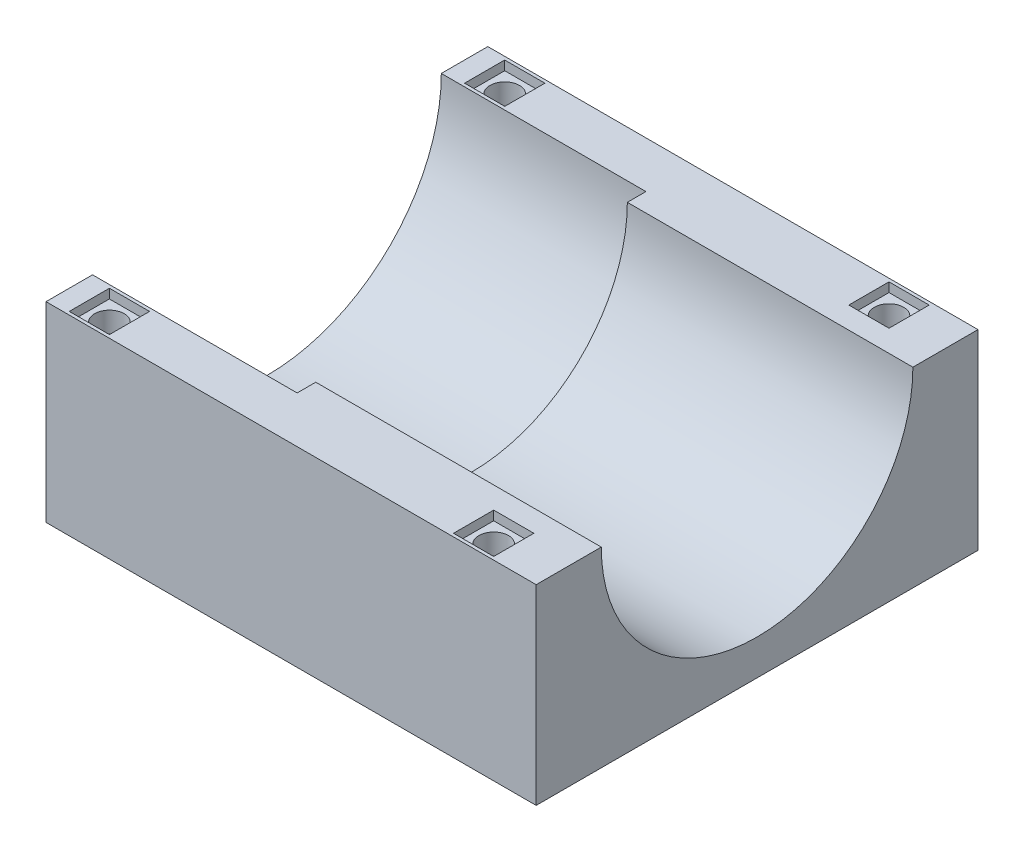
from build123d import *

# Parameters (mm, degrees)
SALIENTE_EXTRUIR1_DEPTH = 22
SALIENTE_EXTRUIR2_DEPTH = 30.7
CORTAR_EXTRUIR2_REACH   = 63.351
CROQUIS4_R              = 1.585
CROQUIS5_W              = 4.32
CROQUIS5_H              = 4.315133256
CROQUIS5_H_2            = 4.32
CORTAR_EXTRUIR3_DEPTH   = 1
CROQUIS6_W              = 4.32
CROQUIS6_H              = 4.32
CORTAR_EXTRUIR4_DEPTH   = 1


with BuildPart() as part:
    # Croquis1 → Saliente-Extruir1 (new body)
    with BuildSketch(Plane(origin=(0, 0, 0), x_dir=(0, 0, -1), z_dir=(1, 0, 0))):
        with BuildLine():
            Line((-23.75, 0), (-18.75, 0))
            ThreePointArc((-18.75, 0), (0, -18.75), (18.75, 0))
            Line((18.75, 0), (23.75, 0))
            Line((23.75, 0), (23.75, -20.555666233))
            Line((23.75, -20.555666233), (-23.75, -20.555666233))
            Line((-23.75, -20.555666233), (-23.75, 0))
        make_face()
    extrude(amount=SALIENTE_EXTRUIR1_DEPTH)

    # Croquis2 → Saliente-Extruir2 (add)
    with BuildSketch(Plane(origin=(22, 0, 0), x_dir=(0, 0, -1), z_dir=(1, 0, 0))):
        with BuildLine():
            Line((16.75, 0), (23.75, 0))
            Line((23.75, 0), (23.75, -20.555666233))
            Line((23.75, -20.555666233), (-23.75, -20.555666233))
            Line((-23.75, -20.555666233), (-23.75, 0))
            Line((-23.75, 0), (-16.75, 0))
            ThreePointArc((-16.75, 0), (0, -16.75), (16.75, 0))
        make_face()
    extrude(amount=SALIENTE_EXTRUIR2_DEPTH)

    # Croquis4 → Cortar-Extruir2 (cut, up to next)
    with BuildSketch(Plane(origin=(0, 0, 0), x_dir=(1, 0, 0), z_dir=(0, 1, 0)), mode=Mode.PRIVATE) as cortar_extruir2_sk1:
        with Locations(Location((4.31807399, 21.25, 0), (0, 0, 270))):
            Circle(CROQUIS4_R)
    cortar_extruir2_tool1 = extrude(cortar_extruir2_sk1.sketch, amount=-CORTAR_EXTRUIR2_REACH, mode=Mode.PRIVATE) & part.part
    # Croquis4 → Cortar-Extruir2 (cut, up to next)
    with BuildSketch(Plane(origin=(0, 0, 0), x_dir=(1, 0, 0), z_dir=(0, 1, 0)), mode=Mode.PRIVATE) as cortar_extruir2_sk2:
        with Locations(Location((45.631200307, 21.25, 0), (0, 0, 270))):
            Circle(CROQUIS4_R)
    cortar_extruir2_tool2 = extrude(cortar_extruir2_sk2.sketch, amount=-CORTAR_EXTRUIR2_REACH, mode=Mode.PRIVATE) & part.part
    cortar_extruir2_1 = cortar_extruir2_tool1.solids().sort_by_distance((4.318074, 0, -21.25))[0]
    add(cortar_extruir2_1, mode=Mode.SUBTRACT)
    cortar_extruir2_2 = cortar_extruir2_tool2.solids().sort_by_distance((45.6312, 0, -21.25))[0]
    add(cortar_extruir2_2, mode=Mode.SUBTRACT)
    cortar_extruir2 = cortar_extruir2_1 + cortar_extruir2_2  # Cortar-Extruir2 as one shape, for the pattern or mirror that repeats it

    # Simetría1: Cortar-Extruir2 across plane
    add(cortar_extruir2.mirror(Plane.XY), mode=Mode.SUBTRACT)

    # Croquis5 → Cortar-Extruir3 (cut)
    with BuildSketch(Plane(origin=(0, 0, 0), x_dir=(1, 0, 0), z_dir=(0, 1, 0))):
        with Locations((4.31807399, -21.25)):
            Rectangle(CROQUIS5_W, CROQUIS5_H)
        with Locations((45.631200307, -21.25)):
            Rectangle(CROQUIS5_W, CROQUIS5_H_2)
    cortar_extruir3 = extrude(amount=-CORTAR_EXTRUIR3_DEPTH, mode=Mode.SUBTRACT)

    # Croquis6 → Cortar-Extruir4 (cut)
    with BuildSketch(Plane.XZ.offset(20.555666233)):
        with Locations((4.31807399, 21.25)):
            Rectangle(CROQUIS6_W, CROQUIS6_H)
        with Locations((45.631200307, 21.25)):
            Rectangle(CROQUIS6_W, CROQUIS6_H)
    cortar_extruir4 = extrude(amount=-CORTAR_EXTRUIR4_DEPTH, mode=Mode.SUBTRACT)

    # Simetría2: Cortar-Extruir3, Cortar-Extruir4 across plane
    add(cortar_extruir3.mirror(Plane.XY), mode=Mode.SUBTRACT)
    add(cortar_extruir4.mirror(Plane.XY), mode=Mode.SUBTRACT)


solid = part.part
